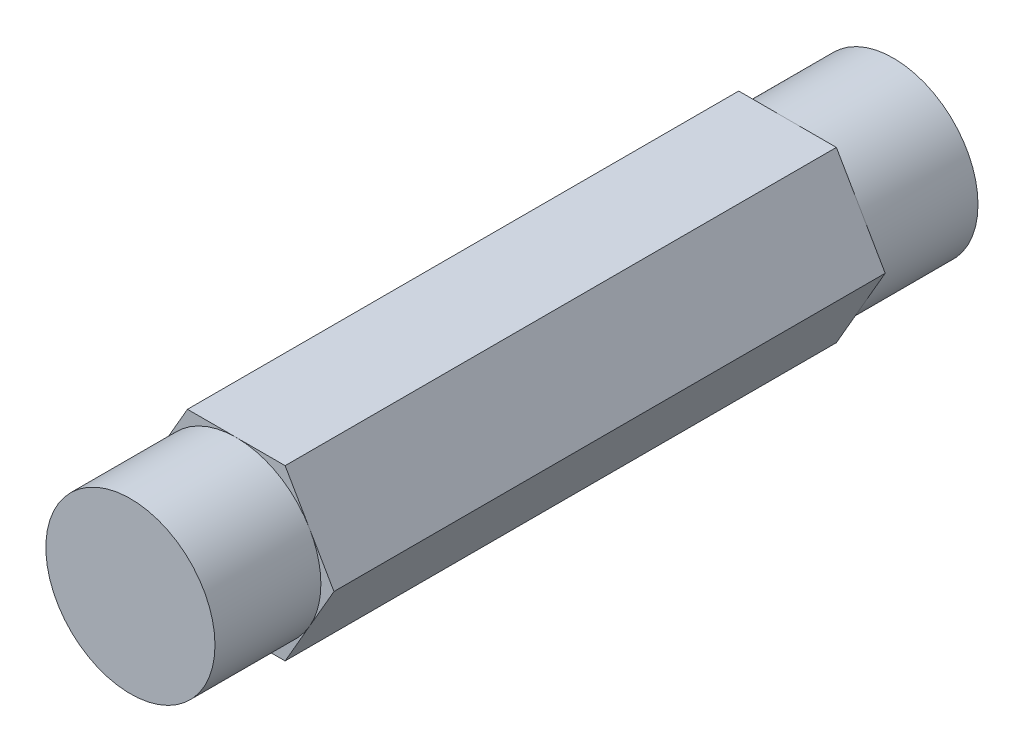
from build123d import *

# Parameters (mm, degrees)
BOSS_EXTRUDE1_DEPTH = 28.64485
SKETCH4_OUTSIDE_W   = 28.762
SKETCH4_OUTSIDE_H   = 26.798
SKETCH4_OUTSIDE_R   = 6.35
CUT_EXTRUDE2_DEPTH  = 7.9502


with BuildPart() as part:
    # Sketch1 → Boss-Extrude1 (new, symmetric)
    with BuildSketch(Plane.XY):
        Polygon((7.332348419, 0), (3.666174209, 6.35), (-3.666174209, 6.35), (-7.332348419, 0), (-3.666174209, -6.35), (3.666174209, -6.35), align=None)
    extrude(amount=BOSS_EXTRUDE1_DEPTH, both=True)

    # Sketch4 outside → Cut-Extrude2 (cut)
    with BuildSketch(Plane.XY.offset(28.64485)):
        Rectangle(SKETCH4_OUTSIDE_W, SKETCH4_OUTSIDE_H)
        Circle(SKETCH4_OUTSIDE_R, mode=Mode.SUBTRACT)
    cut_extrude2 = extrude(amount=-CUT_EXTRUDE2_DEPTH, mode=Mode.SUBTRACT)

    # Mirror1: Cut-Extrude2 across plane
    add(cut_extrude2.mirror(Plane.XY), mode=Mode.SUBTRACT)


solid = part.part
